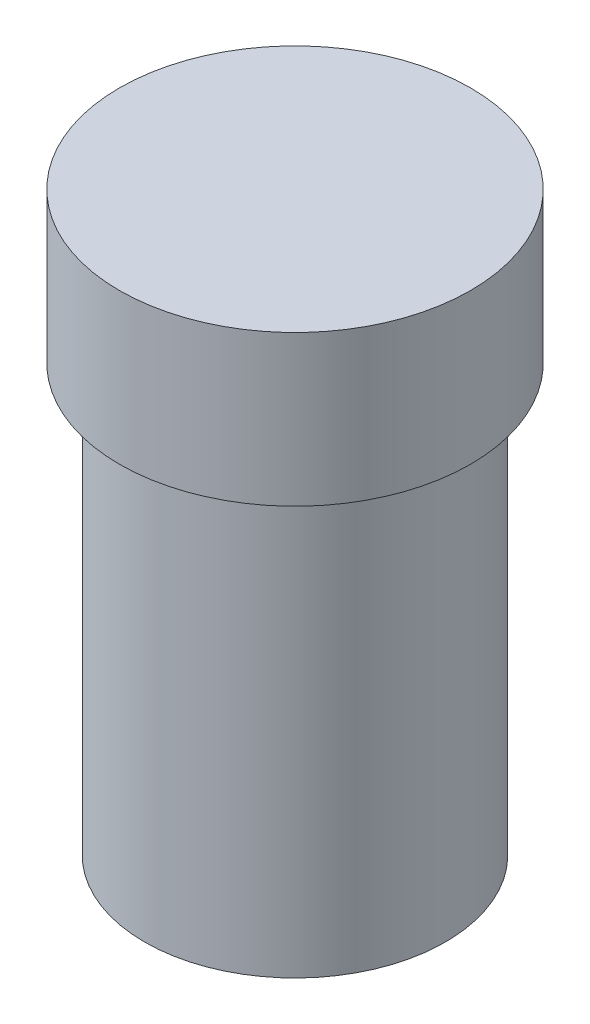
from build123d import *

# Parameters (mm, degrees)
SKETCH1_R           = 7
BOSS_EXTRUDE1_DEPTH = 23
SKETCH2_R           = 7
SKETCH2_R_2         = 6
CUT_EXTRUDE1_DEPTH  = 17


with BuildPart() as part:
    # Sketch1 → Boss-Extrude1 (new body)
    with BuildSketch(Plane(origin=(0, 0, 0), x_dir=(1, 0, 0), z_dir=(0, 1, 0))):
        with Locations(Location((0, 0, 0), (0, 0, 270))):
            Circle(SKETCH1_R)
    extrude(amount=BOSS_EXTRUDE1_DEPTH)

    # Sketch2 → Cut-Extrude1 (cut)
    with BuildSketch(Plane.XZ):
        with Locations(Location((0, 0, 0), (0, 0, 270))):
            Circle(SKETCH2_R)
        with Locations(Location((0, 0, 0), (0, 0, 270))):
            Circle(SKETCH2_R_2, mode=Mode.SUBTRACT)
    extrude(amount=-CUT_EXTRUDE1_DEPTH, mode=Mode.SUBTRACT)


solid = part.part
